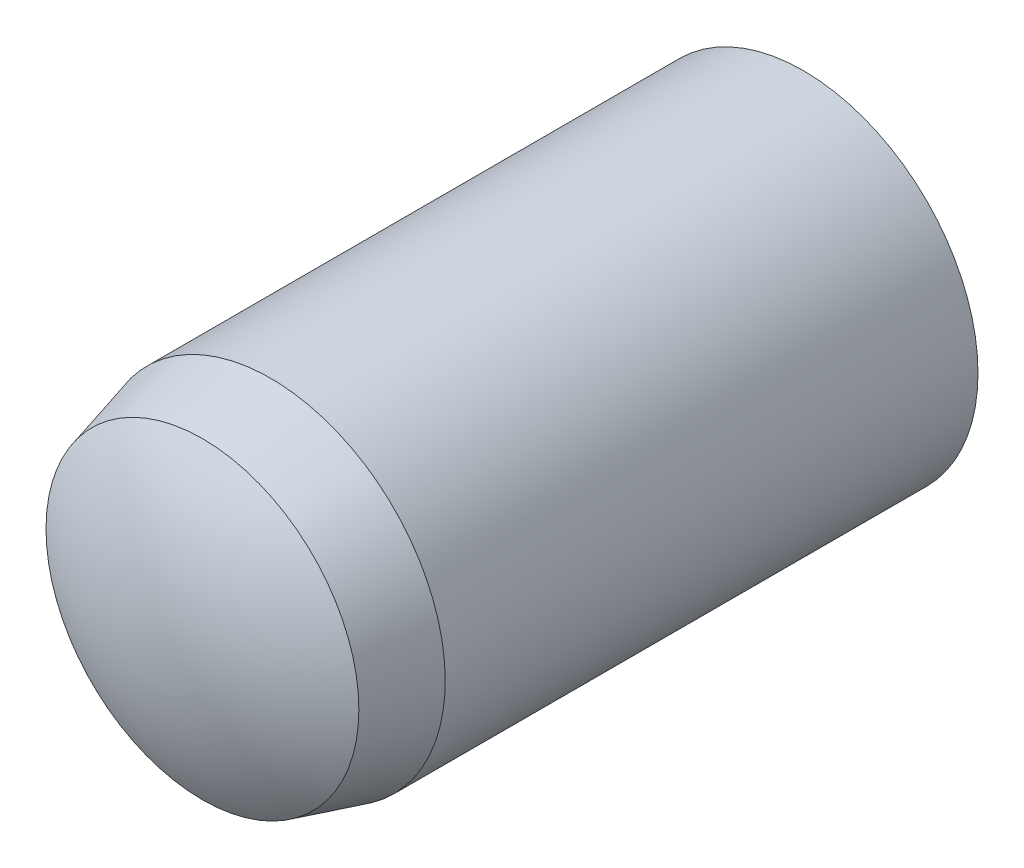
from build123d import *


with BuildPart() as part:
    # Sketch3 → Revolve1 (revolve)
    with BuildSketch(Plane(origin=(0, 0, 0), x_dir=(0, 0, -1), z_dir=(1, 0, 0))):
        with BuildLine():
            Line((-8, 0), (8, 0))
            ThreePointArc((8, 0), (7.693537673, 2.088061302), (6.8, 4))
            Line((6.8, 4), (-5.4, 4))
            Line((-5.4, 4), (-6.96, 3.58199926))
            ThreePointArc((-6.96, 3.58199926), (-7.734740106, 1.864961038), (-8, 0))
        make_face()
    revolve(axis=Axis((0, 0, 8), (0, 0, -1)))


solid = part.part
